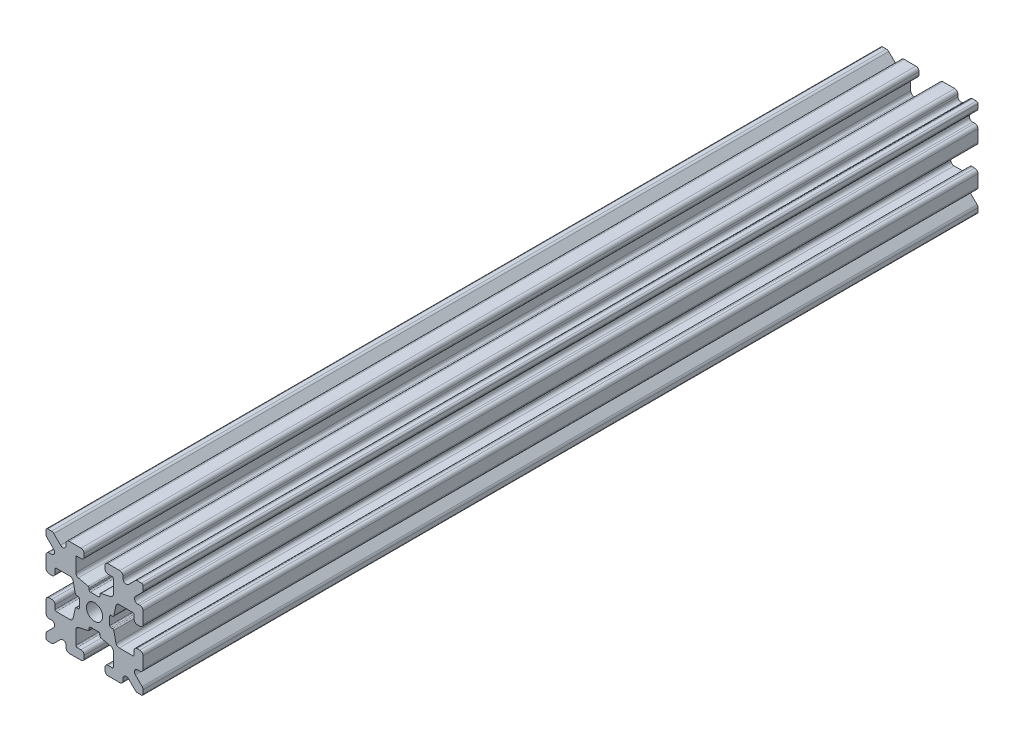
from build123d import *

# Parameters (mm, degrees)
SKETCH1_W           = 15
SKETCH1_H           = 15
SKETCH1_R           = 1.25
BOSS_EXTRUDE1_DEPTH = 64.5
FILLET1_R           = 0.25
CUT_EXTRUDE1_DEPTH  = 130.435312029
CUT_EXTRUDE3_DEPTH  = 130.435312029
FILLET3_R           = 0.5
FILLET4_R           = 0.5
FILLET5_R           = 3
FILLET6_R           = 0.2
CUT_EXTRUDE4_DEPTH  = 130.435312029
FILLET8_R           = 0.5
SKETCH6_W           = 5.1529354
SKETCH6_H           = 1.651
SKETCH6_W_2         = 1.651
SKETCH6_H_2         = 5.1529354
CUT_EXTRUDE5_DEPTH  = 130.435312029
FILLET10_R          = 0.2


with BuildPart() as part:
    # Sketch1 → Boss-Extrude1 (new, symmetric)
    with BuildSketch(Plane.XY):
        Rectangle(SKETCH1_W, SKETCH1_H)
        Circle(SKETCH1_R, mode=Mode.SUBTRACT)
    extrude(amount=BOSS_EXTRUDE1_DEPTH, both=True)

    # Fillet1
    fillet1_edges = [part.edges().sort_by_distance(p)[0] for p in [
        (7.5, -7.5, 0),
        (-7.5, -7.5, 0),
        (-7.5, 7.5, 0),
        (7.5, 7.5, 0),
    ]]
    fillet(fillet1_edges, radius=FILLET1_R)

    # Sketch2 → Cut-Extrude1 (cut, through all)
    with BuildSketch(Plane.XY.offset(64.5)):
        Polygon((-7.5, 1.6), (-6.1, 1.6), (-6.1, 2.9), (-3.4, 2.9), (-3.4, -2.9), (-6.1, -2.9), (-6.1, -1.6), (-7.5, -1.6), align=None)
        Polygon((2.9, 6.1), (1.6, 6.1), (1.6, 7.5), (-1.6, 7.5), (-1.6, 6.1), (-2.9, 6.1), (-2.9, 3.4), (2.9, 3.4), align=None)
        Polygon((-1.6, -7.5), (-1.6, -6.1), (-2.9, -6.1), (-2.9, -3.4), (2.9, -3.4), (2.9, -6.1), (1.6, -6.1), (1.6, -7.5), align=None)
        Polygon((6.1, -2.9), (6.1, -1.6), (7.5, -1.6), (7.5, 1.6), (6.1, 1.6), (6.1, 2.9), (3.4, 2.9), (3.4, -2.9), align=None)
    extrude(amount=-CUT_EXTRUDE1_DEPTH, mode=Mode.SUBTRACT)

    # Sketch4 → Cut-Extrude3 (cut, through all)
    with BuildSketch(Plane.XY.offset(64.5)):
        Polygon((-3.4, 2.9), (-2.75, 0), (-3.4, -2.9), align=None)
        Polygon((-2.9, 3.4), (0, 2.75), (2.9, 3.4), align=None)
        Polygon((3.4, 2.9), (2.75, 0), (3.4, -2.9), align=None)
        Polygon((-2.9, -3.4), (0, -2.75), (2.9, -3.4), align=None)
    extrude(amount=-CUT_EXTRUDE3_DEPTH, mode=Mode.SUBTRACT)

    # Fillet3
    fillet3_edges = [part.edges().sort_by_distance(p)[0] for p in [
        (1.6, -7.5, 0),
        (-1.6, -7.5, 0),
        (-1.6, -6.1, 0),
        (1.6, -6.1, 0),
        (6.1, 1.6, 0),
        (7.5, 1.6, 0),
        (7.5, -1.6, 0),
        (6.1, -1.6, 0),
        (-7.5, -1.6, 0),
        (-7.5, 1.6, 0),
        (-6.1, 1.6, 0),
        (-6.1, -1.6, 0),
        (-1.6, 6.1, 0),
        (-1.6, 7.5, 0),
        (1.6, 7.5, 0),
        (1.6, 6.1, 0),
    ]]
    fillet(fillet3_edges, radius=FILLET3_R)

    # Fillet4
    fillet4_edges = [part.edges().sort_by_distance(p)[0] for p in [
        (-2.9, -3.4, 0),
        (2.9, -3.4, 0),
        (3.4, -2.9, 0),
        (3.4, 2.9, 0),
        (-3.4, 2.9, 0),
        (-3.4, -2.9, 0),
        (2.9, 3.4, 0),
        (-2.9, 3.4, 0),
    ]]
    fillet(fillet4_edges, radius=FILLET4_R)

    # Fillet5
    fillet5_edges = [part.edges().sort_by_distance(p)[0] for p in [
        (-2.75, 0, 0),
        (0, 2.75, 0),
        (2.75, 0, 0),
        (0, -2.75, 0),
    ]]
    fillet(fillet5_edges, radius=FILLET5_R)

    # Fillet6
    fillet6_edges = [part.edges().sort_by_distance(p)[0] for p in [
        (-2.9, -6.1, 0),
        (2.9, -6.1, 0),
        (6.1, -2.9, 0),
        (6.1, 2.9, 0),
        (-6.1, 2.9, 0),
        (-6.1, -2.9, 0),
        (2.9, 6.1, 0),
        (-2.9, 6.1, 0),
    ]]
    fillet(fillet6_edges, radius=FILLET6_R)

    # Sketch5 → Cut-Extrude4 (cut, through all)
    with BuildSketch(Plane.XY.offset(64.5)):
        Polygon((-7.5, 6.439339828), (-5.460660172, 4.4), (-7.5, 4.4), align=None)
        Polygon((-6.439339828, 7.5), (-4.4, 5.460660172), (-4.4, 7.5), align=None)
        Polygon((4.4, 7.5), (6.439339828, 7.5), (4.4, 5.460660172), align=None)
        Polygon((7.5, 6.439339828), (7.5, 4.4), (5.460660172, 4.4), align=None)
        Polygon((7.5, -6.439339828), (5.460660172, -4.4), (7.5, -4.4), align=None)
        Polygon((6.439339828, -7.5), (4.4, -5.460660172), (4.4, -7.5), align=None)
        Polygon((-4.4, -7.5), (-6.439339828, -7.5), (-4.4, -5.460660172), align=None)
        Polygon((-7.5, -6.439339828), (-7.5, -4.4), (-5.460660172, -4.4), align=None)
    extrude(amount=-CUT_EXTRUDE4_DEPTH, mode=Mode.SUBTRACT)

    # Fillet8
    fillet8_edges = [part.edges().sort_by_distance(p)[0] for p in [
        (-7.5, 4.4, 0),
        (-7.5, 6.439339828, 0),
        (-5.460660172, 4.4, 0),
        (7.5, -4.4, 0),
        (7.5, -6.439339828, 0),
        (5.460660172, -4.4, 0),
        (5.460660172, 4.4, 0),
        (7.5, 6.439339828, 0),
        (7.5, 4.4, 0),
        (-4.4, 7.5, 0),
        (-4.4, 5.460660172, 0),
        (-6.439339828, 7.5, 0),
        (-5.460660172, -4.4, 0),
        (-7.5, -6.439339828, 0),
        (-7.5, -4.4, 0),
        (4.4, 5.460660172, 0),
        (4.4, 7.5, 0),
        (6.439339828, 7.5, 0),
        (6.439339828, -7.5, 0),
        (4.4, -7.5, 0),
        (4.4, -5.460660172, 0),
        (-6.439339828, -7.5, 0),
        (-4.4, -5.460660172, 0),
        (-4.4, -7.5, 0),
    ]]
    fillet(fillet8_edges, radius=FILLET8_R)

    # Sketch6 → Cut-Extrude5 (cut, through all)
    with BuildSketch(Plane.XY.offset(64.5)):
        with Locations((4.9235323, 0)):
            Rectangle(SKETCH6_W, SKETCH6_H)
        with Locations((0, -4.9235323)):
            Rectangle(SKETCH6_W_2, SKETCH6_H_2)
        with Locations((-4.9235323, 0)):
            Rectangle(SKETCH6_W, SKETCH6_H)
        with Locations((0, 4.9235323)):
            Rectangle(SKETCH6_W_2, SKETCH6_H_2)
    extrude(amount=-CUT_EXTRUDE5_DEPTH, mode=Mode.SUBTRACT)

    # Fillet10
    fillet10_edges = [part.edges().sort_by_distance(p)[0] for p in [
        (0.8255, -2.935025862, 0),
        (-0.8255, -2.935025862, 0),
        (0.8255, -2.3470646, 0),
        (-0.8255, -2.3470646, 0),
        (2.935025862, 0.8255, 0),
        (2.935025862, -0.8255, 0),
        (2.3470646, 0.8255, 0),
        (2.3470646, -0.8255, 0),
        (-2.935025862, -0.8255, 0),
        (-2.935025862, 0.8255, 0),
        (-2.3470646, -0.8255, 0),
        (-2.3470646, 0.8255, 0),
        (-0.8255, 2.935025862, 0),
        (0.8255, 2.935025862, 0),
        (-0.8255, 2.3470646, 0),
        (0.8255, 2.3470646, 0),
    ]]
    fillet(fillet10_edges, radius=FILLET10_R)


solid = part.part
